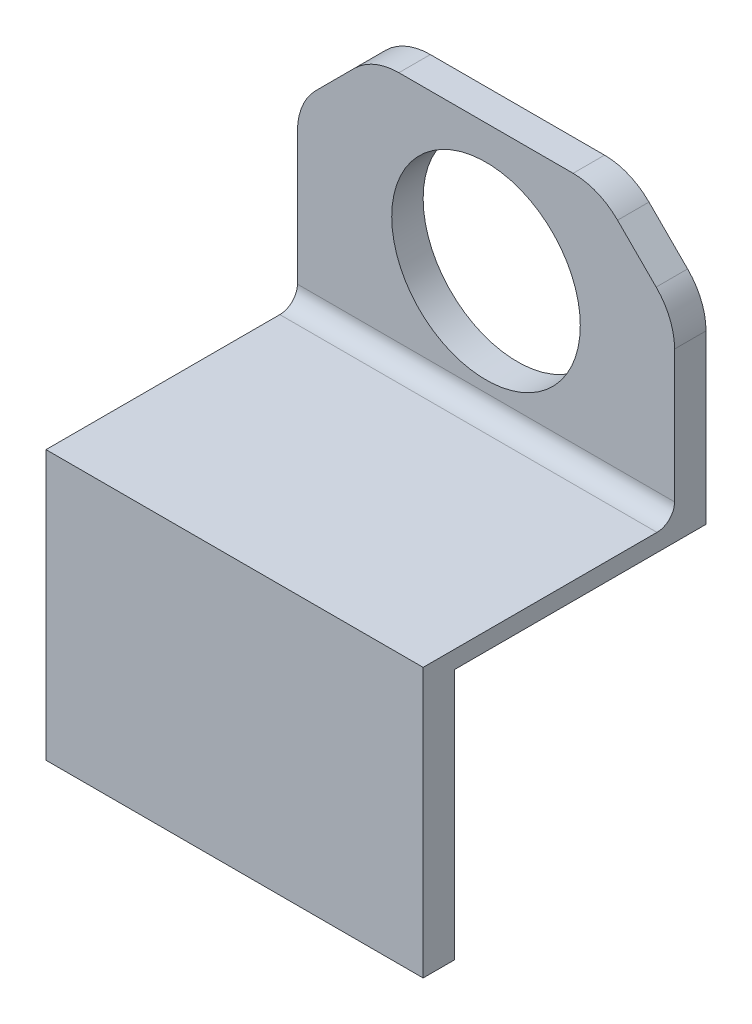
from build123d import *

# Parameters (mm, degrees)
SKETCH1_W           = 38.1
SKETCH1_H           = 25.4
BOSS_EXTRUDE1_DEPTH = 1.5875
SKETCH2_W           = 38.1
SKETCH2_H           = 28.575
BOSS_EXTRUDE2_DEPTH = 1.778
SKETCH3_W           = 38.1
SKETCH3_H           = 3.175
BOSS_EXTRUDE3_DEPTH = 25.4
SKETCH5_R           = 9.525
CUT_EXTRUDE1_DEPTH  = 51.973693058
CHAMFER1_SIZE       = 7.62
FILLET1_R           = 6.35
FILLET2_R           = 1.778


with BuildPart() as part:
    # Sketch1 → Boss-Extrude1 (new, symmetric)
    with BuildSketch(Plane.XY):
        Rectangle(SKETCH1_W, SKETCH1_H)
    extrude(amount=BOSS_EXTRUDE1_DEPTH, both=True)

    # Sketch2 → Boss-Extrude2 (add)
    with BuildSketch(Plane(origin=(0, 12.7, 0), x_dir=(1, 0, 0), z_dir=(0, 1, 0))):
        with Locations((0, 12.7)):
            Rectangle(SKETCH2_W, SKETCH2_H)
    extrude(amount=BOSS_EXTRUDE2_DEPTH)

    # Sketch3 → Boss-Extrude3 (add)
    with BuildSketch(Plane(origin=(0, 14.478, 0), x_dir=(1, 0, 0), z_dir=(0, 1, 0))):
        with Locations((0, 25.4)):
            Rectangle(SKETCH3_W, SKETCH3_H)
    extrude(amount=BOSS_EXTRUDE3_DEPTH)

    # Sketch5 → Cut-Extrude1 (cut, through all)
    with BuildSketch(Plane.XY.offset(-23.8125)):
        with Locations((0, 26.924)):
            Circle(SKETCH5_R)
    extrude(amount=-CUT_EXTRUDE1_DEPTH, mode=Mode.SUBTRACT)

    # Chamfer1
    chamfer1_edges = [part.edges().sort_by_distance(p)[0] for p in [
        (-19.05, 39.878, -25.4),
        (19.05, 39.878, -25.4),
    ]]
    chamfer(chamfer1_edges, length=CHAMFER1_SIZE)

    # Fillet1
    fillet1_edges = [part.edges().sort_by_distance(p)[0] for p in [
        (-19.05, 32.258, -25.4),
        (-11.43, 39.878, -25.4),
        (19.05, 32.258, -25.4),
        (11.43, 39.878, -25.4),
    ]]
    fillet(fillet1_edges, radius=FILLET1_R)

    # Fillet2
    fillet2_edges = [part.edges().sort_by_distance(p)[0] for p in [
        (0, 14.478, -23.8125),
    ]]
    fillet(fillet2_edges, radius=FILLET2_R)


solid = part.part
